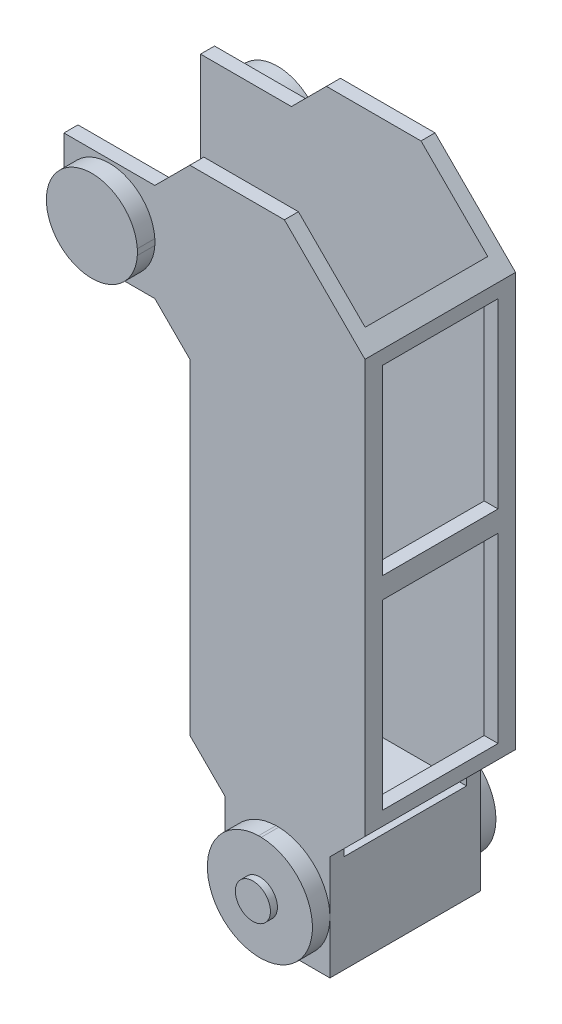
from build123d import *

# Parameters (mm, degrees)
SKETCH1_R           = 14.5
BOSS_EXTRUDE1_DEPTH = 43
SKETCH1_5_R         = 14.5
BOSS_EXTRUDE2_DEPTH = 43
BOSS_EXTRUDE3_DEPTH = 43
BOSS_EXTRUDE4_DEPTH = 5
SKETCH1_8_R         = 14.5
BOSS_EXTRUDE5_DEPTH = 5
SKETCH3_R           = 5
BOSS_EXTRUDE6_DEPTH = 2
BOSS_EXTRUDE7_DEPTH = 5
BOSS_EXTRUDE8_DEPTH = 5
SKETCH5_R           = 5
BOSS_EXTRUDE9_DEPTH = 2
SKETCH6_W           = 35
SKETCH6_H           = 27.979977464
CUT_EXTRUDE1_DEPTH  = 82
SKETCH7_W           = 65.1
SKETCH7_H           = 35
CUT_EXTRUDE4_DEPTH  = 153
SKETCH9_W           = 33
SKETCH9_H           = 52
CUT_EXTRUDE5_DEPTH  = 33


with BuildPart() as part:
    # Sketch1 → Boss-Extrude1 (new body)
    with BuildSketch(Plane.XY):
        with BuildLine():
            Line((-17, 80.5), (-42.944942798, 80.5))
            Line((-42.944942798, 80.5), (-42.944942798, 67.345568333))
            ThreePointArc((-42.944942798, 67.345568333), (-29.549463234, 79.493116027), (-16.972471399, 66.5))
            ThreePointArc((-16.972471399, 66.5), (-29.549463234, 53.506883973), (-42.944942798, 65.654431667))
            Line((-42.944942798, 65.654431667), (-42.944942798, 52.520022536))
            Line((-42.944942798, 52.520022536), (-17, 52.520022536))
            Line((-17, 52.520022536), (-7, 42.520022536))
            Line((-7, 42.520022536), (-7, -50.479977464))
            Line((-7, -50.479977464), (3, -60.479977464))
            Line((3, -60.479977464), (3, -90.479977464))
            Line((3, -90.479977464), (33, -90.479977464))
            Line((33, -90.479977464), (33, -60.5))
            Line((33, -60.5), (43, -50.5))
            Line((43, -50.5), (43, 67.5))
            Line((43, 67.5), (20, 90.5))
            Line((20, 90.5), (-7, 90.5))
            Line((-7, 90.5), (-17, 80.5))
        make_face()
        with Locations((17.898375843, -75.5)):
            Circle(SKETCH1_R, mode=Mode.SUBTRACT)
    extrude(amount=BOSS_EXTRUDE1_DEPTH)

    # Sketch1<5> → Boss-Extrude2 (add)
    with BuildSketch(Plane.XY):
        with Locations((17.898375843, -75.5)):
            Circle(SKETCH1_5_R)
    extrude(amount=BOSS_EXTRUDE2_DEPTH)

    # Sketch1<6> → Boss-Extrude3 (add)
    with BuildSketch(Plane.XY):
        with BuildLine():
            ThreePointArc((-16.972471399, 66.5), (-29.549463234, 79.493116027), (-42.944942798, 67.345568333))
            Line((-42.944942798, 67.345568333), (-42.944942798, 65.654431667))
            ThreePointArc((-42.944942798, 65.654431667), (-29.549463234, 53.506883973), (-16.972471399, 66.5))
        make_face()
    extrude(amount=BOSS_EXTRUDE3_DEPTH)

    # Sketch1<7> → Boss-Extrude4 (add)
    with BuildSketch(Plane.XY):
        with BuildLine():
            ThreePointArc((-16.972471399, 66.5), (-29.549463234, 79.493116027), (-42.944942798, 67.345568333))
            Line((-42.944942798, 67.345568333), (-42.944942798, 65.654431667))
            ThreePointArc((-42.944942798, 65.654431667), (-29.549463234, 53.506883973), (-16.972471399, 66.5))
        make_face()
    extrude(amount=-BOSS_EXTRUDE4_DEPTH)

    # Sketch1<8> → Boss-Extrude5 (add)
    with BuildSketch(Plane.XY):
        with Locations((17.898375843, -75.5)):
            Circle(SKETCH1_8_R)
    extrude(amount=-BOSS_EXTRUDE5_DEPTH)

    # Sketch3 → Boss-Extrude6 (add)
    with BuildSketch(Plane(origin=(0, 0, -5), x_dir=(-1, 0, 0), z_dir=(0, 0, -1))):
        with Locations((-17.898375843, -75.5)):
            Circle(SKETCH3_R)
    extrude(amount=BOSS_EXTRUDE6_DEPTH)

    # Sketch4 → Boss-Extrude7 (add)
    with BuildSketch(Plane.XY.offset(43)):
        with BuildLine():
            ThreePointArc((-17, 67.355579601), (-29.972471399, 79.510011268), (-42.944942798, 67.355579601))
            Line((-42.944942798, 67.355579601), (-42.944942798, 65.664442935))
            ThreePointArc((-42.944942798, 65.664442935), (-29.972471399, 53.510011268), (-17, 65.664442935))
            Line((-17, 65.664442935), (-17, 67.355579601))
        make_face()
    extrude(amount=BOSS_EXTRUDE7_DEPTH)

    # Sketch4<3> → Boss-Extrude8 (add)
    with BuildSketch(Plane.XY.offset(43)):
        with BuildLine():
            ThreePointArc((17.62239464, -60.489736711), (3.000000814, -75.480042097), (17.612515852, -90.479977464))
            Line((17.612515852, -90.479977464), (18.387484148, -90.479977464))
            ThreePointArc((18.387484148, -90.479977464), (32.999999143, -75.490053363), (18.397621205, -60.490254111))
            Line((18.397621205, -60.490254111), (17.62239464, -60.489736711))
        make_face()
    extrude(amount=BOSS_EXTRUDE8_DEPTH)

    # Sketch5 → Boss-Extrude9 (add)
    with BuildSketch(Plane.XY.offset(48)):
        with Locations((18, -75.484983098)):
            Circle(SKETCH5_R)
    extrude(amount=BOSS_EXTRUDE9_DEPTH)

    # Sketch6 → Cut-Extrude1 (cut)
    with BuildSketch(Plane.ZY.offset(42.944942798)):
        with Locations((21.5, 66.510011268)):
            Rectangle(SKETCH6_W, SKETCH6_H)
    extrude(amount=-CUT_EXTRUDE1_DEPTH, mode=Mode.SUBTRACT)

    # Sketch7 → Cut-Extrude4 (cut)
    with BuildSketch(Plane(origin=(0, 90.5, 0), x_dir=(1, 0, 0), z_dir=(0, 1, 0))):
        with Locations((6.5, -21.5)):
            Rectangle(SKETCH7_W, SKETCH7_H)
    extrude(amount=-CUT_EXTRUDE4_DEPTH, mode=Mode.SUBTRACT)

    # Sketch9 → Cut-Extrude5 (cut)
    with BuildSketch(Plane(origin=(43, 0, 0), x_dir=(0, 0, -1), z_dir=(1, 0, 0))):
        with Locations((-21.5, 37.5)):
            Rectangle(SKETCH9_W, SKETCH9_H)
        with Locations((-21.5, -20.5)):
            Rectangle(SKETCH9_W, SKETCH9_H)
    extrude(amount=-CUT_EXTRUDE5_DEPTH, mode=Mode.SUBTRACT)


solid = part.part
